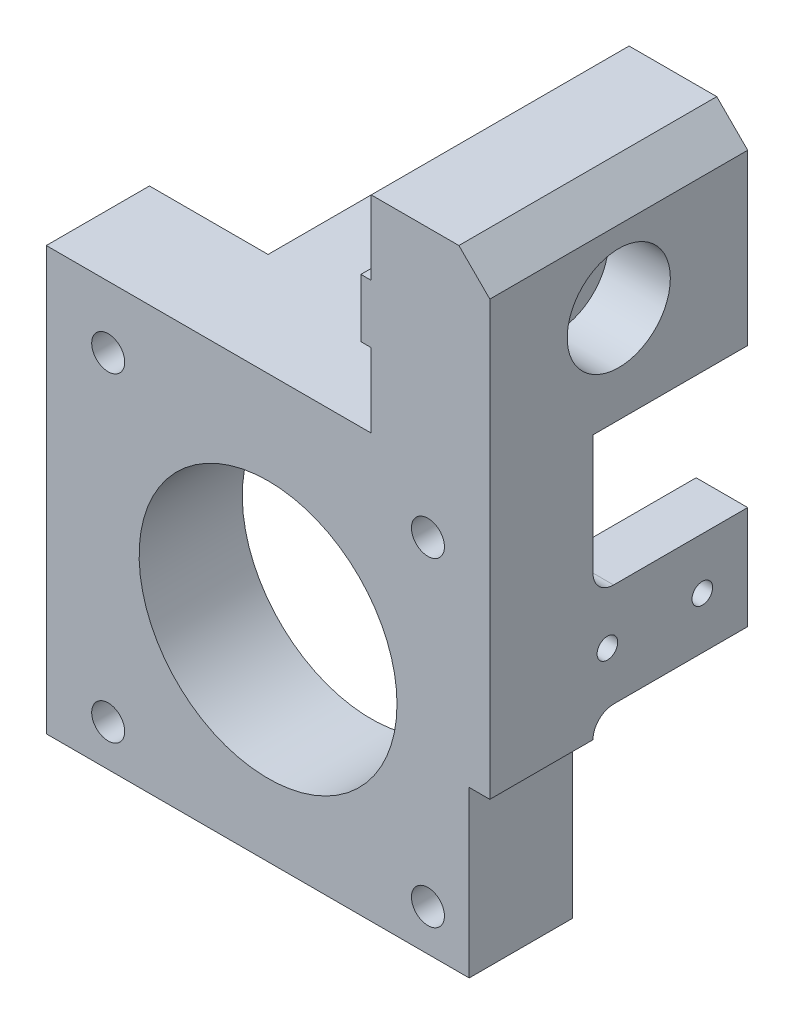
from build123d import *
from build123d.topology import SkipClean

# Parameters (mm, degrees)
ESBO_O1_R                  = 12.5
ESBO_O1_R_2                = 1.6
RESSALTO_EXTRUS_O1_DEPTH   = 10
ESBO_O3_R                  = 3.6
CORTE_EXTRUS_O1_DEPTH      = 3
RESSALTO_EXTRUS_O2_START   = 15
RESSALTO_EXTRUS_O2_DEPTH   = 15
ESBO_O4_R                  = 2.25
CORTE_EXTRUS_O2_DEPTH      = 62.613715961
ESBO_O5_R                  = 2.25
CORTE_EXTRUS_O3_DEPTH      = 51.361196938
ESBO_O6_R                  = 5
CORTE_EXTRUS_O4_DEPTH      = 3.5
ESBO_O7_R                  = 5
CORTE_EXTRUS_O5_DEPTH      = 6
ESBO_O8_R                  = 1
RESSALTO_EXTRUS_O3_DEPTH   = 5
CORTE_EXTRUS_O7_DEPTH      = 10
CORTE_EXTRUS_O7_DEPTH_BACK = 2
FILETE1_R                  = 2
CORTE_EXTRUS_O8_DEPTH      = 50.08665705
CORTE_EXTRUS_O8_DEPTH_BACK = 50.08665705


with BuildPart() as part:
    # Esboço1 → Ressalto-extrusão1 (new body)
    with BuildSketch(Plane.XY):
        Polygon((-21.50000073, 21.50000073), (-21.50000073, -21.50000073), (21.50000073, -21.50000073), (21.50000073, 38.499999791), (18.500000238, 41.49999842), (9.999999776, 41.49999842), (9.999999776, 34.324999575), (8.999999613, 34.324999575), (8.999999613, 28.674999575), (9.999999776, 28.674999575), (9.999999776, 21.50000073), align=None)
        Circle(ESBO_O1_R, mode=Mode.SUBTRACT)
        with Locations((-15.5, 15.5)):
            Circle(ESBO_O1_R_2, mode=Mode.SUBTRACT)
        with Locations((15.5, 15.5)):
            Circle(ESBO_O1_R_2, mode=Mode.SUBTRACT)
        with Locations((15.5, -15.5)):
            Circle(ESBO_O1_R_2, mode=Mode.SUBTRACT)
        with Locations((-15.5, -15.5)):
            Circle(ESBO_O1_R_2, mode=Mode.SUBTRACT)
    extrude(amount=RESSALTO_EXTRUS_O1_DEPTH)

    # Esboço3 → Corte-extrusão1 (cut)
    with BuildSketch(Plane(origin=(0, 0, 0), x_dir=(-1, 0, 0), z_dir=(0, 0, -1))):
        with Locations((-15.5, 15.5)):
            Circle(ESBO_O3_R)
        with Locations((15.5, 15.5)):
            Circle(ESBO_O3_R)
        with Locations((15.5, -15.5)):
            Circle(ESBO_O3_R)
        with Locations((-15.5, -15.5)):
            Circle(ESBO_O3_R)
    extrude(amount=-CORTE_EXTRUS_O1_DEPTH, mode=Mode.SUBTRACT)

    # Esboço2 → Ressalto-extrusão2 (add)
    with SkipClean():  # the faces are left unmerged after this step: merging them gives an invalid solid
        with BuildSketch(Plane(origin=(0, 0, 0), x_dir=(-1, 0, 0), z_dir=(0, 0, -1)).offset(RESSALTO_EXTRUS_O2_START)):
            with BuildLine():
                Line((-18.500000238, 41.49999842), (-21.50000073, 38.499999791))
                Line((-21.50000073, 38.499999791), (-21.50000073, 22.1))
                Line((-21.50000073, 22.1), (-18.50000073, 19.1))
                Line((-18.50000073, 19.1), (-15.5, 19.1))
                ThreePointArc((-15.5, 19.1), (-12.954415588, 18.045584412), (-11.9, 15.5))
                Line((-11.9, 15.5), (-11.9, 13.5))
                Line((-11.9, 13.5), (-10.9, 12.5))
                Line((-10.9, 12.5), (6.99999927, 12.5))
                Line((6.99999927, 12.5), (9.99999927, 15.5))
                Line((9.99999927, 15.5), (9.99999927, 21.50000073))
                Line((9.99999927, 21.50000073), (-9.999999776, 21.50000073))
                Line((-9.999999776, 21.50000073), (-9.999999776, 28.674999575))
                Line((-9.999999776, 28.674999575), (-8.999999613, 28.674999575))
                Line((-8.999999613, 28.674999575), (-8.999999613, 34.324999575))
                Line((-8.999999613, 34.324999575), (-9.999999776, 34.324999575))
                Line((-9.999999776, 34.324999575), (-9.999999776, 41.49999842))
                Line((-9.999999776, 41.49999842), (-18.500000238, 41.49999842))
            make_face()
        extrude(amount=-RESSALTO_EXTRUS_O2_DEPTH)

    # Esboço4 → Corte-extrusão2 (cut, through all)
    with SkipClean():  # the faces are left unmerged after this step: merging them gives an invalid solid
        with BuildSketch(Plane(origin=(21.50000073, 0, 0), x_dir=(0, 0, -1), z_dir=(1, 0, 0))):
            with Locations((2.5, 31.49999842)):
                Circle(ESBO_O4_R)
        extrude(amount=-CORTE_EXTRUS_O2_DEPTH, mode=Mode.SUBTRACT)

    # Esboço5 → Corte-extrusão3 (cut, through all)
    with SkipClean():  # the faces are left unmerged after this step: merging them gives an invalid solid
        with BuildSketch(Plane(origin=(0, 21.50000073, 0), x_dir=(1, 0, 0), z_dir=(0, 1, 0))):
            with Locations(Location((0, 7.5, 0), (0, 0, 180))):
                Circle(ESBO_O5_R)
        extrude(amount=-CORTE_EXTRUS_O3_DEPTH, mode=Mode.SUBTRACT)

    # Esboço6 → Corte-extrusão4 (cut)
    with SkipClean():  # the faces are left unmerged after this step: merging them gives an invalid solid
        with BuildSketch(Plane.XZ.offset(-12.5)):
            with Locations((0, -7.5)):
                Circle(ESBO_O6_R)
        extrude(amount=-CORTE_EXTRUS_O4_DEPTH, mode=Mode.SUBTRACT)

    # Esboço7 → Corte-extrusão5 (cut)
    with SkipClean():  # the faces are left unmerged after this step: merging them gives an invalid solid
        with BuildSketch(Plane(origin=(21.50000073, 0, 0), x_dir=(0, 0, -1), z_dir=(1, 0, 0))):
            with Locations((2.5, 31.49999842)):
                Circle(ESBO_O7_R)
        extrude(amount=-CORTE_EXTRUS_O5_DEPTH, mode=Mode.SUBTRACT)

    # Esboço8 → Ressalto-extrusão3 (add)
    with SkipClean():  # the faces are left unmerged after this step: merging them gives an invalid solid
        with BuildSketch(Plane(origin=(21.50000073, 0, 0), x_dir=(0, 0, -1), z_dir=(1, 0, 0))):
            Polygon((0, 8.49999927), (15, 8.49999927), (15, -1.50000073), (0, -1.50000073), (-2, -1.50000073), (-2, 8.49999927), align=None)
            with Locations((1.4, 3.49999927)):
                Circle(ESBO_O8_R, mode=Mode.SUBTRACT)
            with Locations((10.6, 3.49999927)):
                Circle(ESBO_O8_R, mode=Mode.SUBTRACT)
        extrude(amount=-RESSALTO_EXTRUS_O3_DEPTH)

    # Esboço9 → Corte-extrusão7 (cut, two sides: drawn at the far end of the back side and taken through both)
    with BuildSketch(Plane.ZY.offset(-16.50000073).offset(-CORTE_EXTRUS_O7_DEPTH_BACK)):
        Polygon((-9.0988893, 0.89999927), (-7.5977786, 3.49999927), (-9.0988893, 6.09999927), (-12.1011107, 6.09999927), (-13.6022214, 3.49999927), (-12.1011107, 0.89999927), align=None)
        Polygon((-4.4022214, 3.49999927), (-2.9011107, 0.89999927), (0.1011107, 0.89999927), (1.6022214, 3.49999927), (0.1011107, 6.09999927), (-2.9011107, 6.09999927), align=None)
    extrude(amount=CORTE_EXTRUS_O7_DEPTH + CORTE_EXTRUS_O7_DEPTH_BACK, mode=Mode.SUBTRACT)

    # Filete1
    filete1_edges = [part.edges().sort_by_distance(p)[0] for p in [
        (16.50000073, -0.30000073, 0),
        (19.00000073, 8.49999927, 0),
        (19.00000073, -1.50000073, 0),
        (16.50000073, 7.29999927, 0),
    ]]
    fillet(filete1_edges, radius=FILETE1_R)

    # Esboço10 → Corte-extrusão8 (cut, two sides: drawn at the far end of the back side and taken through both)
    with SkipClean():  # the faces are left unmerged after this step: merging them gives an invalid solid
        with BuildSketch(Plane(origin=(0, 0, 0), x_dir=(-1, 0, 0), z_dir=(0, 0, -1)).offset(-CORTE_EXTRUS_O8_DEPTH_BACK)):
            Polygon((-21.50000073, -3.50000073), (-19.50000073, -3.50000073), (-19.50000073, -19.50000073), (21.50000073, -19.50000073), (21.50000073, -21.50000073), (-19.50000073, -21.50000073), (-21.50000073, -21.50000073), align=None)
        extrude(amount=CORTE_EXTRUS_O8_DEPTH + CORTE_EXTRUS_O8_DEPTH_BACK, mode=Mode.SUBTRACT)


solid = part.part
